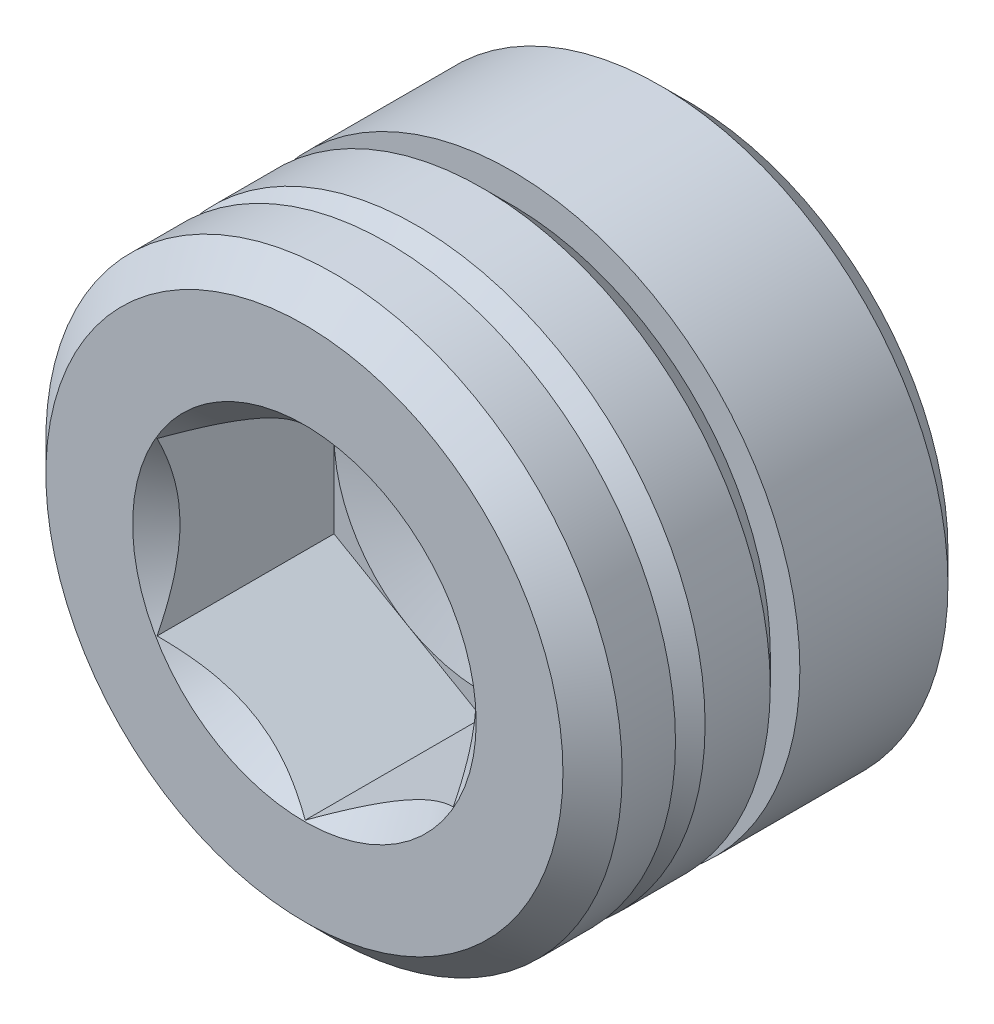
from build123d import *

# Parameters (mm, degrees)
CUT_EXTRUDE1_DEPTH = 3


with BuildPart() as part:
    # Sketch1 → Revolve1 (revolve)
    with BuildSketch(Plane(origin=(0, 0, 0), x_dir=(0, 0, -1), z_dir=(1, 0, 0)), mode=Mode.PRIVATE) as revolve1_sk:
        Polygon((0, 0), (0, 4.365), (0.5, 4.865), (6, 4.865), (6.5, 4.365), (6.5, 0), align=None)
    revolve(revolve1_sk.sketch.rotate(Axis((0, 0, -6.5), (0, 0, 1)), 270), axis=Axis((0, 0, -6.5), (0, 0, 1)))

    # Sketch2 → Cut-Revolve1 (revolve, cut)
    with BuildSketch(Plane(origin=(0, 0, 0), x_dir=(0, 0, -1), z_dir=(1, 0, 0)), mode=Mode.PRIVATE) as cut_revolve1_sk:
        Polygon((0, 4.865), (1.4, 4.865), (1.4, 4.365), (1.9, 4.865), (3, 4.865), (3.5, 4.365), (3.5, 4.865), (6.5, 4.865), (6.5, 9.865), (0, 9.865), align=None)
    revolve(cut_revolve1_sk.sketch.rotate(Axis((0, 0, -6.5), (0, 0, 1)), 270), axis=Axis((0, 0, -6.5), (0, 0, 1)), mode=Mode.SUBTRACT)

    # Sketch3 → Cut-Revolve2 (revolve, cut)
    with BuildSketch(Plane(origin=(0, 0, 0), x_dir=(0, 0, -1), z_dir=(1, 0, 0)), mode=Mode.PRIVATE) as cut_revolve2_sk:
        Polygon((0, 0), (0, 2.9), (0.4, 2.5), (3, 2.5), (3.69331136, 0), align=None)
    revolve(cut_revolve2_sk.sketch.rotate(Axis((0, 0, -3.69331136), (0, 0, 1)), 270), axis=Axis((0, 0, -3.69331136), (0, 0, 1)), mode=Mode.SUBTRACT)

    # Sketch4 → Cut-Extrude1 (cut)
    with BuildSketch(Plane.XY):
        Polygon((-2.5, -1.443375673), (0, -2.886751346), (2.5, -1.443375673), (2.5, 1.443375673), (0, 2.886751346), (-2.5, 1.443375673), align=None)
    extrude(amount=-CUT_EXTRUDE1_DEPTH, mode=Mode.SUBTRACT)


solid = part.part
